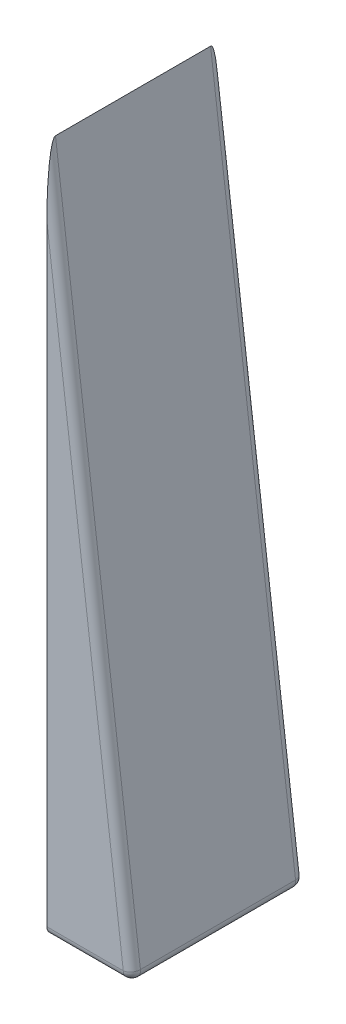
from build123d import *

# Parameters (mm, degrees)
SKETCH1_W           = 12.7
SKETCH1_H           = 25.4
BOSS_EXTRUDE1_DEPTH = 101.6
CUT_EXTRUDE1_DEPTH  = 105.919218926
FILLET1_R           = 1.27


with BuildPart() as part:
    # Sketch1 → Boss-Extrude1 (new body)
    with BuildSketch(Plane(origin=(0, 0, 0), x_dir=(1, 0, 0), z_dir=(0, 1, 0))):
        Rectangle(SKETCH1_W, SKETCH1_H)
    extrude(amount=BOSS_EXTRUDE1_DEPTH)

    # Sketch2 → Cut-Extrude1 (cut, through all)
    with BuildSketch(Plane.XY.offset(12.7)):
        Polygon((6.35, 0), (-6.35, 101.6), (6.35, 101.6), align=None)
    extrude(amount=-CUT_EXTRUDE1_DEPTH, mode=Mode.SUBTRACT)

    # Fillet1
    fillet1_edges = [part.edges().sort_by_distance(p)[0] for p in [
        (0, 50.8, -12.7),
        (0, 50.8, 12.7),
        (0, 0, 12.7),
        (0, 0, -12.7),
        (6.35, 0, 0),
    ]]
    fillet(fillet1_edges, radius=FILLET1_R)


solid = part.part
